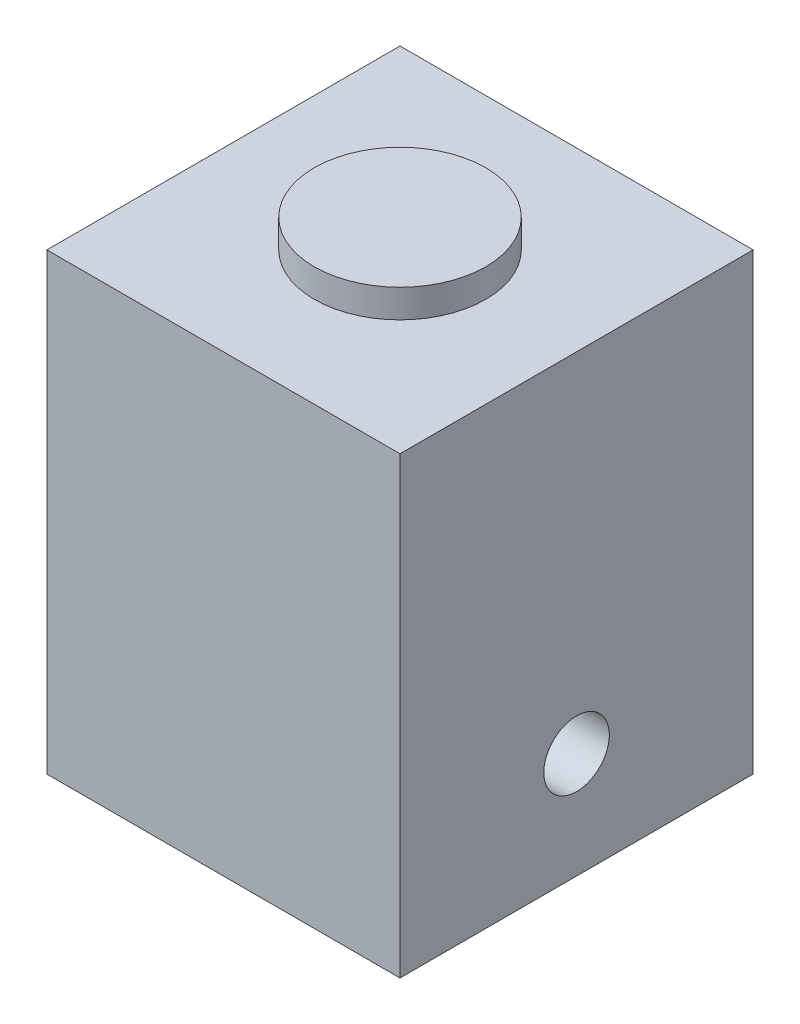
from build123d import *

# Parameters (mm, degrees)
SKETCH_1_W          = 35
SKETCH_1_H          = 35
EXTRUDE_1_DEPTH     = 45
SKETCH_2_R          = 8.5
EXTRUDE_2_DEPTH     = 2.8
SKETCH_4_W          = 24
SKETCH_4_H          = 24
CUT_EXTRUDE_1_DEPTH = 40
SKETCH_5_R          = 3.25
CUT_EXTRUDE_2_DEPTH = 62.774509306


with BuildPart() as part:
    # 草图1 → 凸台-拉伸1 (new body)
    with BuildSketch(Plane(origin=(0, 0, 0), x_dir=(1, 0, 0), z_dir=(0, 1, 0))):
        Rectangle(SKETCH_1_W, SKETCH_1_H)
    extrude(amount=EXTRUDE_1_DEPTH)

    # 草图2 → 凸台-拉伸2 (add)
    with BuildSketch(Plane(origin=(0, 45, 0), x_dir=(1, 0, 0), z_dir=(0, 1, 0))):
        with Locations(Location((0, 0, 0), (0, 0, 270))):
            Circle(SKETCH_2_R)
    extrude(amount=EXTRUDE_2_DEPTH)

    # 草图4 → 切除-拉伸1 (cut)
    with BuildSketch(Plane.XZ):
        Rectangle(SKETCH_4_W, SKETCH_4_H)
    extrude(amount=-CUT_EXTRUDE_1_DEPTH, mode=Mode.SUBTRACT)

    # 草图5 → 切除-拉伸2 (cut, through all)
    with BuildSketch(Plane(origin=(17.5, 0, 0), x_dir=(0, 0, -1), z_dir=(1, 0, 0))):
        with Locations((0, 10.5)):
            Circle(SKETCH_5_R)
    extrude(amount=-CUT_EXTRUDE_2_DEPTH, mode=Mode.SUBTRACT)


solid = part.part
